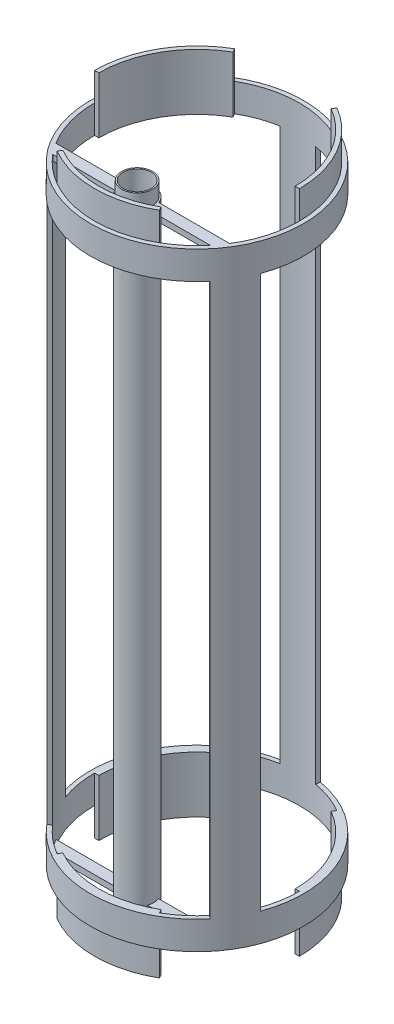
from build123d import *

# Parameters (mm, degrees)
SKETCH_1_R           = 37.85
SKETCH_1_R_2         = 36.35
EXTRUDE_1_DEPTH      = 10
EXTRUDE_6_DEPTH      = 2
SKETCH_1_8_R         = 5.5
SKETCH_1_8_R_2       = 5
EXTRUDE_7_DEPTH      = 5
EXTRUDE_8_DEPTH      = 10
EXTRUDE_8_DEPTH_BACK = 10
SKETCH_1_11_R        = 6
SKETCH_1_11_R_2      = 5
EXTRUDE_9_DEPTH      = 215


with BuildPart() as part:
    # Эскиз1 → Бобышка-Вытянуть1 (new body)
    with BuildSketch(Plane(origin=(0, 0, 0), x_dir=(1, 0, 0), z_dir=(0, 1, 0))):
        Circle(SKETCH_1_R)
        Circle(SKETCH_1_R_2, mode=Mode.SUBTRACT)
    extrude(amount=EXTRUDE_1_DEPTH)

    # Эскиз1<7> → Бобышка-Вытянуть6 (add)
    with BuildSketch(Plane(origin=(0, 0, 0), x_dir=(1, 0, 0), z_dir=(0, 1, 0))):
        with BuildLine():
            ThreePointArc((5.656854249, -19.25), (6, -21.25), (5.656854249, -23.25))
            Line((5.656854249, -23.25), (27.942082957, -23.25))
            ThreePointArc((27.942082957, -23.25), (29.456215486, -21.299151843), (30.834396378, -19.25))
            Line((30.834396378, -19.25), (5.656854249, -19.25))
        make_face()
        with BuildLine():
            ThreePointArc((-30.834396378, -19.25), (-29.456215486, -21.299151843), (-27.942082957, -23.25))
            Line((-27.942082957, -23.25), (-5.656854249, -23.25))
            ThreePointArc((-5.656854249, -23.25), (-6, -21.25), (-5.656854249, -19.25))
            Line((-5.656854249, -19.25), (-30.834396378, -19.25))
        make_face()
    extrude(amount=EXTRUDE_6_DEPTH)

    # Эскиз1<9> → Бобышка-Вытянуть8 (add, two sides: drawn at the far end of the back side and taken through both)
    with BuildSketch(Plane(origin=(0, 0, 0), x_dir=(1, 0, 0), z_dir=(0, 1, 0)).offset(-EXTRUDE_8_DEPTH_BACK)):
        with BuildLine():
            Line((-36.35, 0), (-34.85, 0))
            ThreePointArc((-34.85, 0), (-30.180985322, 17.425), (-17.425, 30.180985322))
            Line((-17.425, 30.180985322), (-18.175, 31.480023428))
            ThreePointArc((-18.175, 31.480023428), (-31.480023428, 18.175), (-36.35, 0))
        make_face()
        with BuildLine():
            Line((18.175, 31.480023428), (17.425, 30.180985322))
            ThreePointArc((17.425, 30.180985322), (30.180985322, 17.425), (34.85, 0))
            Line((34.85, 0), (36.35, 0))
            ThreePointArc((36.35, 0), (31.480023428, 18.175), (18.175, 31.480023428))
        make_face()
        with BuildLine():
            Line((18.175, -31.480023428), (17.425, -30.180985322))
            ThreePointArc((17.425, -30.180985322), (0, -34.85), (-17.425, -30.180985322))
            Line((-17.425, -30.180985322), (-18.175, -31.480023428))
            ThreePointArc((-18.175, -31.480023428), (0, -36.35), (18.175, -31.480023428))
        make_face()
    extrude(amount=EXTRUDE_8_DEPTH + EXTRUDE_8_DEPTH_BACK)



with BuildPart() as body_2:
    # Эскиз1<8> → Бобышка-Вытянуть7 (new body)
    with BuildSketch(Plane(origin=(0, 0, 0), x_dir=(1, 0, 0), z_dir=(0, 1, 0))):
        with Locations((0, -21.25)):
            Circle(SKETCH_1_8_R)
        with Locations((0, -21.25)):
            Circle(SKETCH_1_8_R_2, mode=Mode.SUBTRACT)
    extrude(amount=-EXTRUDE_7_DEPTH)


with BuildPart() as part_1:
    add(part.part)

    add(body_2.part)  # Бобышка-Вытянуть9 merges body 2
    # Эскиз1<11> → Бобышка-Вытянуть9 (add)
    # profile 1 of 4: a face of its own
    with BuildSketch(Plane(origin=(0, 0, 0), x_dir=(1, 0, 0), z_dir=(0, 1, 0))):
        with Locations((0, -21.25)):
            Circle(SKETCH_1_11_R)
        with Locations((0, -21.25)):
            Circle(SKETCH_1_11_R_2, mode=Mode.SUBTRACT)
    # profile 2 of 4: a face of its own
    with BuildSketch(Plane(origin=(0, 0, 0), x_dir=(1, 0, 0), z_dir=(0, 1, 0))):
        with BuildLine():
            ThreePointArc((-6.312111258, 35.797761822), (0, 36.35), (6.312111258, 35.797761822))
            Line((6.312111258, 35.797761822), (6.572583525, 37.274973452))
            ThreePointArc((6.572583525, 37.274973452), (0, 37.85), (-6.572583525, 37.274973452))
            Line((-6.572583525, 37.274973452), (-6.312111258, 35.797761822))
        make_face()
    # profile 3 of 4: a face of its own
    with BuildSketch(Plane(origin=(0, 0, 0), x_dir=(1, 0, 0), z_dir=(0, 1, 0))):
        with BuildLine():
            Line((35.567365697, -12.945462425), (34.157826766, -12.43243221))
            ThreePointArc((34.157826766, -12.43243221), (31.480023428, -18.175), (27.845715507, -23.365329612))
            Line((27.845715507, -23.365329612), (28.994782172, -24.329511027))
            ThreePointArc((28.994782172, -24.329511027), (32.779061533, -18.925), (35.567365697, -12.945462425))
        make_face()
    # profile 4 of 4: a face of its own
    with BuildSketch(Plane(origin=(0, 0, 0), x_dir=(1, 0, 0), z_dir=(0, 1, 0))):
        with BuildLine():
            Line((-34.157826766, -12.43243221), (-35.567365697, -12.945462425))
            ThreePointArc((-35.567365697, -12.945462425), (-32.779061533, -18.925), (-28.994782172, -24.329511027))
            Line((-28.994782172, -24.329511027), (-27.845715507, -23.365329612))
            ThreePointArc((-27.845715507, -23.365329612), (-31.480023428, -18.175), (-34.157826766, -12.43243221))
        make_face()
    extrude(amount=EXTRUDE_9_DEPTH)

    # Зеркальное отражение1: part across plane


with BuildPart() as part_2:
    add(part_1.part)
    add(part_1.part.mirror(Plane.ZX.offset(108)))


solid = part_2.part
